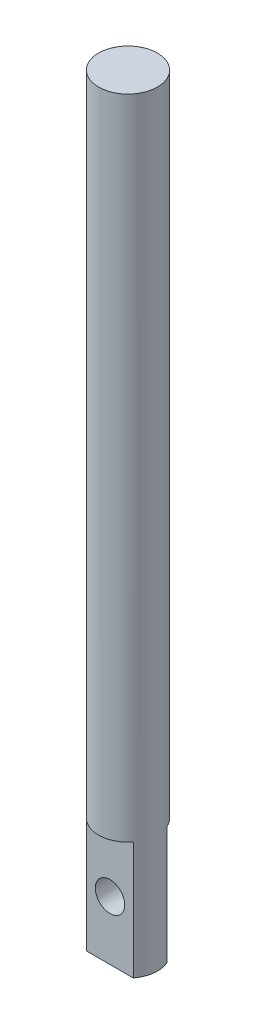
from build123d import *

# Parameters (mm, degrees)
ESQUISSE1_R             = 5
BOSS_EXTRU_1_DEPTH      = 130
ENL_V_MAT_EXTRU_2_DEPTH = 20
ENL_V_MAT_EXTRU_3_DEPTH = 20
ESQUISSE4_R             = 2.5
ENL_V_MAT_EXTRU_4_DEPTH = 60


with BuildPart() as part:
    # Esquisse1 → Boss.-Extru.1 (new body)
    with BuildSketch(Plane(origin=(0, 0, 0), x_dir=(1, 0, 0), z_dir=(0, 1, 0))):
        with Locations(Location((0, 0, 0), (0, 0, 270))):
            Circle(ESQUISSE1_R)
    extrude(amount=BOSS_EXTRU_1_DEPTH)

    # Esquisse2 → Enlèv. mat.-Extru.2 (cut)
    with BuildSketch(Plane(origin=(0, 0, 0), x_dir=(-1, 0, 0), z_dir=(0, -1, 0))):
        with BuildLine():
            Line((-4.582575695, 2), (4.582575695, 2))
            ThreePointArc((4.582575695, 2), (4.582464701, 2.0002543), (4.582353692, 2.000508595))
            ThreePointArc((4.582353692, 2.000508595), (-0.000277468, 4.999999992), (-4.582575695, 2))
        make_face()
    extrude(amount=-ENL_V_MAT_EXTRU_2_DEPTH, mode=Mode.SUBTRACT)

    # Esquisse3 → Enlèv. mat.-Extru.3 (cut)
    with BuildSketch(Plane.XZ):
        with BuildLine():
            ThreePointArc((3.95513796, 3.058902371), (0, 5), (-3.95513796, 3.058902371))
            Line((-3.95513796, 3.058902371), (3.95513796, 3.058902371))
        make_face()
    extrude(amount=-ENL_V_MAT_EXTRU_3_DEPTH, mode=Mode.SUBTRACT)

    # Esquisse4 → Enlèv. mat.-Extru.4 (cut)
    with BuildSketch(Plane.XY.offset(3.058902371)):
        with Locations((0.00513796, 10)):
            Circle(ESQUISSE4_R)
    extrude(amount=-ENL_V_MAT_EXTRU_4_DEPTH, mode=Mode.SUBTRACT)


solid = part.part
